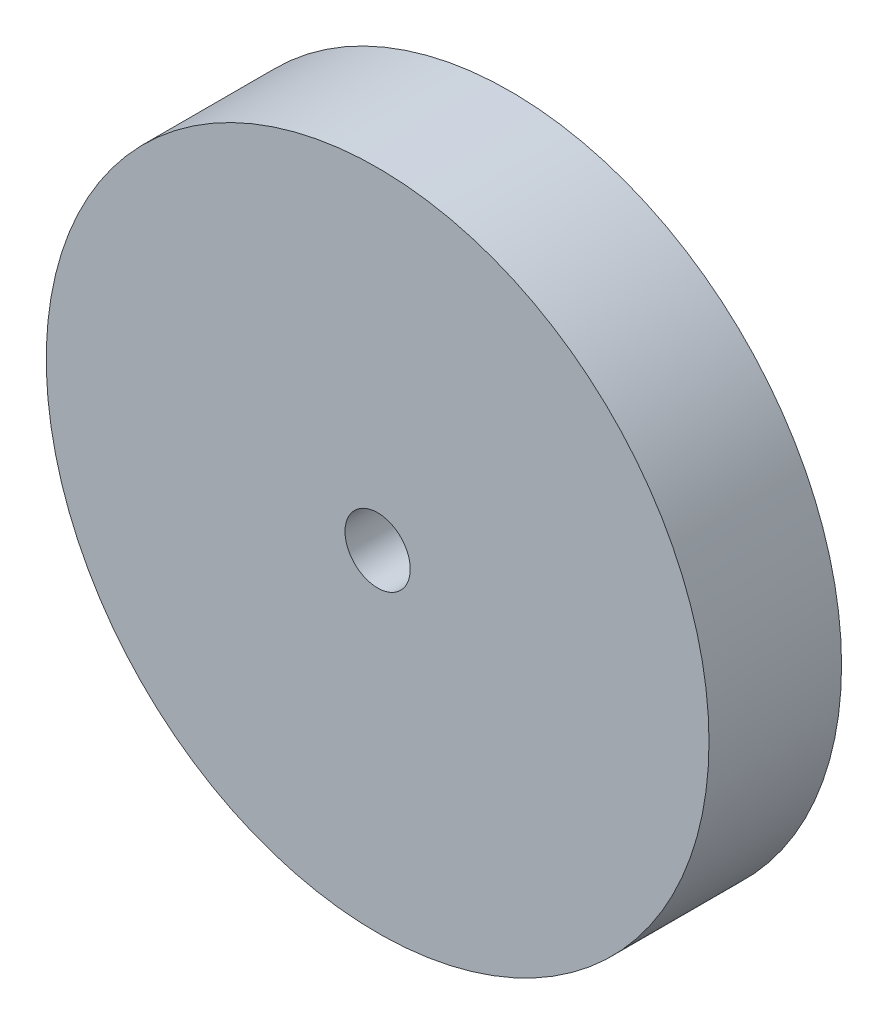
from build123d import *

# Parameters (mm, degrees)
SKETCH1_R              = 127
BOSS_EXTRUDE1_DEPTH    = 50.8
F_25_0MM_DOWEL_HOLE1_D = 25


with BuildPart() as part:
    # Sketch1 → Boss-Extrude1 (new body)
    with BuildSketch(Plane.XY):
        Circle(SKETCH1_R)
    extrude(amount=BOSS_EXTRUDE1_DEPTH)

    # Ø25.0mm Dowel Hole1 (through all)
    with Locations(Plane(origin=(0, 0, 0), x_dir=(-1, 0, 0), z_dir=(0, 0, -1))):
        with Locations((0, 0)):
            Hole(F_25_0MM_DOWEL_HOLE1_D / 2)


solid = part.part
